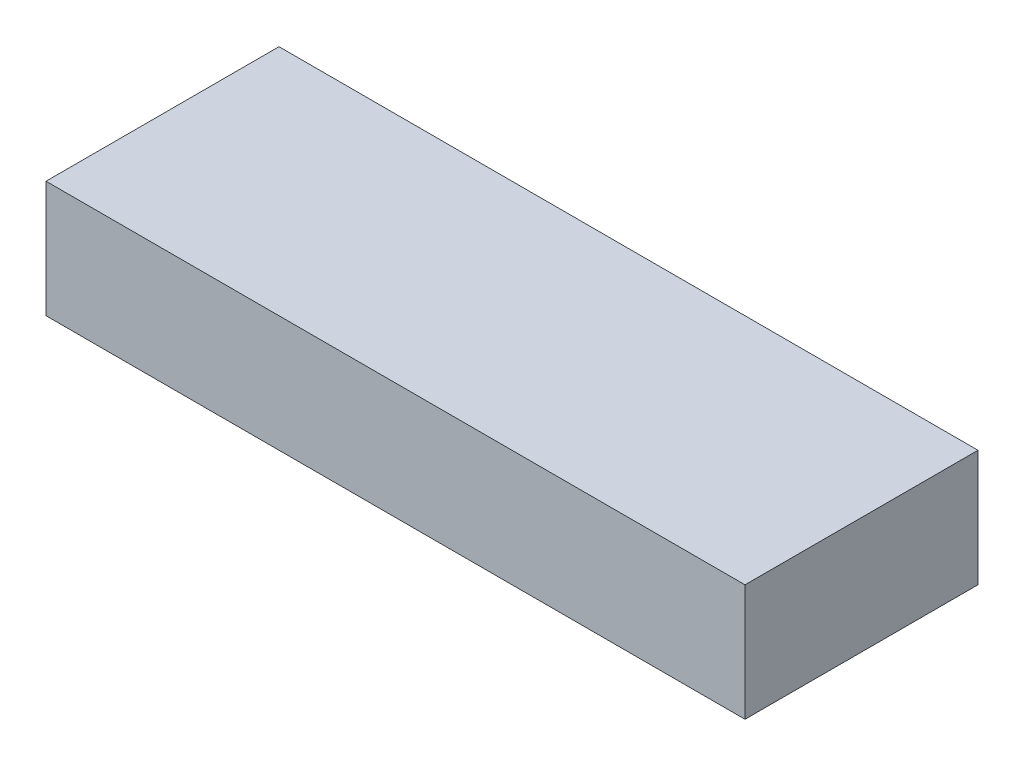
from build123d import *

# Parameters (mm, degrees)
EXTRUDE_1_DEPTH      = 15
EXTRUDE_1_DEPTH_BACK = 15
SKETCH_1_W           = 180
SKETCH_1_H           = 60


with BuildPart() as part:
    # 草图1 → 凸台-拉伸1 (new, two sides: drawn at the far end of the back side and taken through both)
    with BuildSketch(Plane(origin=(0, 0, 0), x_dir=(1, 0, 0), z_dir=(0, 1, 0)).offset(-EXTRUDE_1_DEPTH_BACK)):
        Rectangle(SKETCH_1_W, SKETCH_1_H)
    extrude(amount=EXTRUDE_1_DEPTH + EXTRUDE_1_DEPTH_BACK)


solid = part.part
